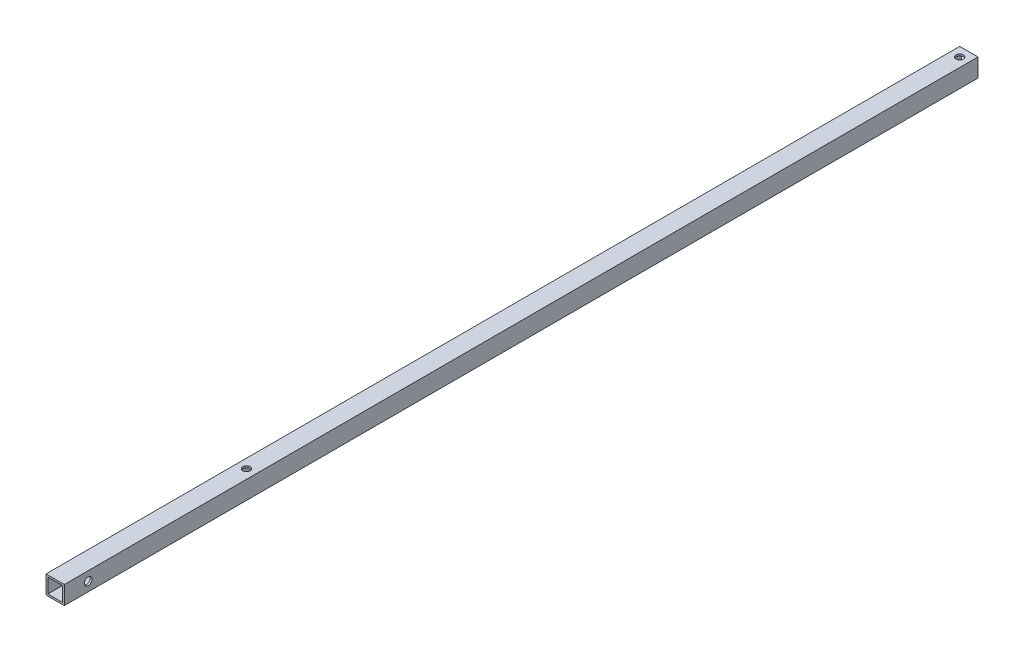
from build123d import *

# Parameters (mm, degrees)
SKETCH_1_W          = 10
SKETCH_1_H          = 10
SKETCH_1_W_2        = 8
SKETCH_1_H_2        = 8
EXTRUDE_1_DEPTH     = 499
SKETCH_2_R          = 2
CUT_EXTRUDE_1_DEPTH = 500.125234786
SKETCH_3_R          = 2.1
CUT_EXTRUDE_2_DEPTH = 500.125234786


with BuildPart() as part:
    # ｽｹｯﾁ1 → 押し出し-薄板1 (new body)
    with BuildSketch(Plane.XY):
        Rectangle(SKETCH_1_W, SKETCH_1_H)
        Rectangle(SKETCH_1_W_2, SKETCH_1_H_2, mode=Mode.SUBTRACT)
    extrude(amount=EXTRUDE_1_DEPTH)

    # ｽｹｯﾁ2 → ｶｯﾄ - 押し出し1 (cut, through all)
    with BuildSketch(Plane(origin=(0, 5, 0), x_dir=(1, 0, 0), z_dir=(0, 1, 0))):
        with Locations(Location((0, -5, 0), (0, 0, 270))):
            Circle(SKETCH_2_R)
        with Locations(Location((0, -394.5, 0), (0, 0, 270))):
            Circle(SKETCH_2_R)
    extrude(amount=-CUT_EXTRUDE_1_DEPTH, mode=Mode.SUBTRACT)

    # ｽｹｯﾁ3 → ｶｯﾄ - 押し出し2 (cut, through all)
    with BuildSketch(Plane(origin=(5, 0, 0), x_dir=(0, 0, -1), z_dir=(1, 0, 0))):
        with Locations((-485.96, 0)):
            Circle(SKETCH_3_R)
    extrude(amount=-CUT_EXTRUDE_2_DEPTH, mode=Mode.SUBTRACT)


solid = part.part
